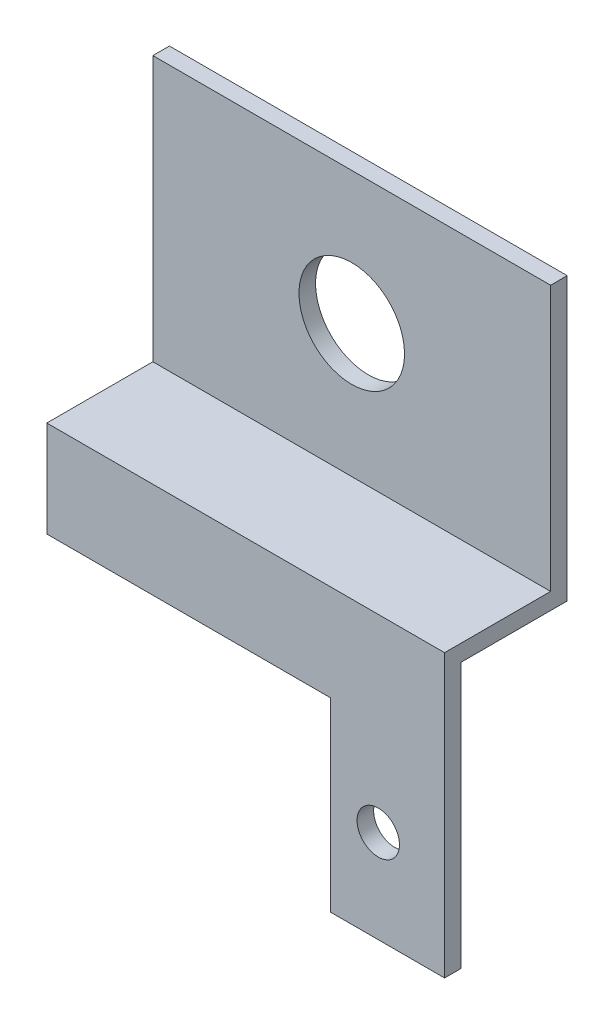
from build123d import *

# Parameters (mm, degrees)
BOSS_EXTRUDE1_DEPTH        = 19.05
F_8_0_199_DIAMETER_HOLE1_D = 5.0546
SKETCH4_R                  = 1.016
SKETCH4_W                  = 13.589
SKETCH4_H                  = 8.89
CUT_EXTRUDE1_DEPTH         = 24.89121573


with BuildPart() as part:
    # Sketch1 → Boss-Extrude1 (new body)
    with BuildSketch(Plane(origin=(0, 0, 0), x_dir=(0, 0, -1), z_dir=(1, 0, 0))):
        Polygon((-14.980334091, -13.49375), (-14.980334091, 0), (-9.900334091, 0), (-9.900334091, 12.7), (-9.106584091, 12.7), (-9.106584091, -0.79375), (-14.186584091, -0.79375), (-14.186584091, -13.49375), align=None)
    extrude(amount=BOSS_EXTRUDE1_DEPTH)

    # #8 (0.199) Diameter Hole1 (through all)
    with Locations(Plane(origin=(9.525, 6.35, 9.900334091), x_dir=(1, 0, 0), z_dir=(0, 0, 1))):
        with Locations((0, 0)):
            Hole(F_8_0_199_DIAMETER_HOLE1_D / 2)

    # Sketch4 → Cut-Extrude1 (cut, through all)
    with BuildSketch(Plane(origin=(0, 0, 14.186584091), x_dir=(-1, 0, 0), z_dir=(0, 0, -1))):
        with Locations(Location((-15.875, -9.04875, 0), (0, 0, 90))):
            Circle(SKETCH4_R)
        with Locations((-6.7945, -9.04875)):
            Rectangle(SKETCH4_W, SKETCH4_H)
    extrude(amount=-CUT_EXTRUDE1_DEPTH, mode=Mode.SUBTRACT)


solid = part.part
